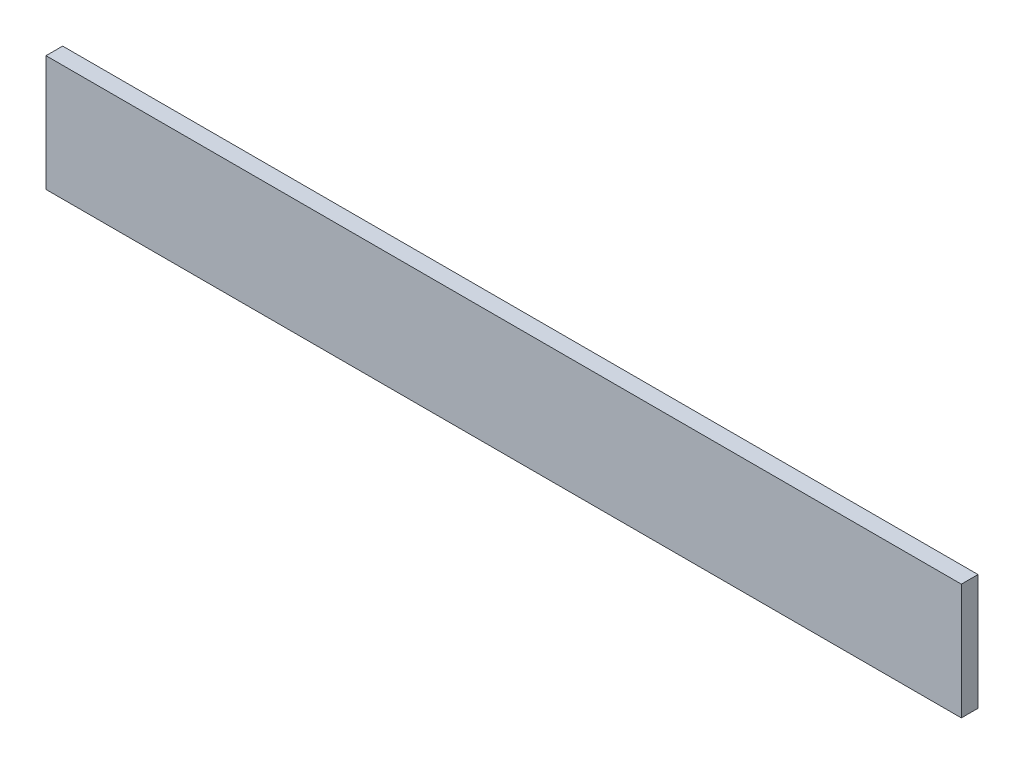
from build123d import *

# Parameters (mm, degrees)
SKETCH1_W           = 1003.3
SKETCH1_H           = 127
BOSS_EXTRUDE1_DEPTH = 18.25625


with BuildPart() as part:
    # Sketch1 → Boss-Extrude1 (new body)
    with BuildSketch(Plane.XY):
        Rectangle(SKETCH1_W, SKETCH1_H)
    extrude(amount=BOSS_EXTRUDE1_DEPTH)


solid = part.part
